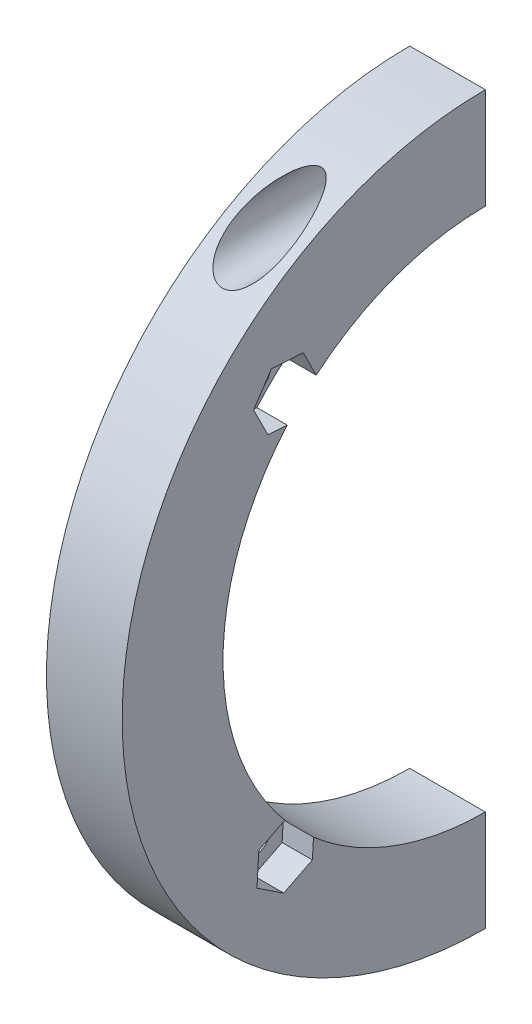
from build123d import *

# Parameters (mm, degrees)
BOSS_EXTRUDE1_DEPTH      = 3.75
BOSS_EXTRUDE1_DEPTH_BACK = 3.75
SKETCH1_R                = 1.5
SKETCH3_R                = 1.5
CUT_EXTRUDE1_DEPTH       = 25.5
SKETCH4_R                = 2.75
CUT_EXTRUDE2_DEPTH       = 25
CUT_EXTRUDE3_DEPTH       = 25
CUT_EXTRUDE4_DEPTH       = 3


with BuildPart() as part:
    # Sketch1 → Boss-Extrude1 (new, two sides: drawn at the far end of the back side and taken through both)
    with BuildSketch(Plane(origin=(0, 0, 0), x_dir=(0, 0, -1), z_dir=(1, 0, 0)).offset(-BOSS_EXTRUDE1_DEPTH_BACK)):
        with BuildLine():
            Line((0, 26), (0, 36))
            ThreePointArc((0, 36), (-36, 0), (0, -36))
            Line((0, -36), (0, -26))
            ThreePointArc((0, -26), (-24.020867845, -9.949769241), (-18.384776311, 18.384776311))
            ThreePointArc((-18.384776311, 18.384776311), (-9.949769241, 24.020867845), (0, 26))
        make_face()
        with Locations((-19.798989873, -19.798989873)):
            Circle(SKETCH1_R, mode=Mode.SUBTRACT)
        with BuildLine():
            ThreePointArc((-18.298989873, 19.798989873), (-18.413170574, 19.224964725), (-18.738329701, 18.738329701))
            ThreePointArc((-18.738329701, 18.738329701), (-21.184809172, 20.373015022), (-18.298989873, 19.798989873))
        make_face(mode=Mode.SUBTRACT)
    extrude(amount=BOSS_EXTRUDE1_DEPTH + BOSS_EXTRUDE1_DEPTH_BACK)

    # Sketch3 → Cut-Extrude1 (cut)
    with BuildSketch(Plane(origin=(0, 0, 0), x_dir=(-1, 0, 0), z_dir=(0, 0, -1))):
        with Locations((0, 31)):
            Circle(SKETCH3_R)
    cut_extrude1 = extrude(amount=-CUT_EXTRUDE1_DEPTH, mode=Mode.SUBTRACT)

    # Mirror1: Cut-Extrude1 across plane
    add(cut_extrude1.mirror(Plane.ZX), mode=Mode.SUBTRACT)

    # Sketch4 → Cut-Extrude2 (cut)
    with BuildSketch(Plane(origin=(0, 0, 30), x_dir=(-1, 0, 0), z_dir=(0, 0, -1))):
        with Locations((0, 31)):
            Circle(SKETCH4_R)
    extrude(amount=CUT_EXTRUDE2_DEPTH, mode=Mode.SUBTRACT)

    # Sketch5 → Cut-Extrude3 (cut)
    with BuildSketch(Plane(origin=(0, 0, 30), x_dir=(-1, 0, 0), z_dir=(0, 0, -1))):
        Polygon((2.75, -32.58771324), (2.75, -29.41228676), (0, -27.824573519), (-2.75, -29.41228676), (-2.75, -32.58771324), (0, -34.175426481), align=None)
    extrude(amount=CUT_EXTRUDE3_DEPTH, mode=Mode.SUBTRACT)

    # Sketch6 → Cut-Extrude4 (cut)
    with BuildSketch(Plane(origin=(3.75, 0, 0), x_dir=(0, 0, -1), z_dir=(1, 0, 0))):
        Polygon((-22.45221952, -18.054367916), (-22.636491632, -21.224443171), (-19.983261985, -22.969065128), (-17.145760226, -21.543611831), (-16.961488115, -18.373536576), (-19.614717761, -16.628914618), align=None)
        Polygon((-18.054367916, 22.45221952), (-21.224443171, 22.636491632), (-22.969065128, 19.983261985), (-21.543611831, 17.145760226), (-18.373536576, 16.961488115), (-16.628914618, 19.614717761), align=None)
        Polygon((18.054367916, -22.45221952), (21.224443171, -22.636491632), (22.969065128, -19.983261985), (21.543611831, -17.145760226), (18.373536576, -16.961488115), (16.628914618, -19.614717761), align=None)
        Polygon((22.45221952, 18.054367916), (22.636491632, 21.224443171), (19.983261985, 22.969065128), (17.145760226, 21.543611831), (16.961488115, 18.373536576), (19.614717761, 16.628914618), align=None)
    extrude(amount=-CUT_EXTRUDE4_DEPTH, mode=Mode.SUBTRACT)


solid = part.part
